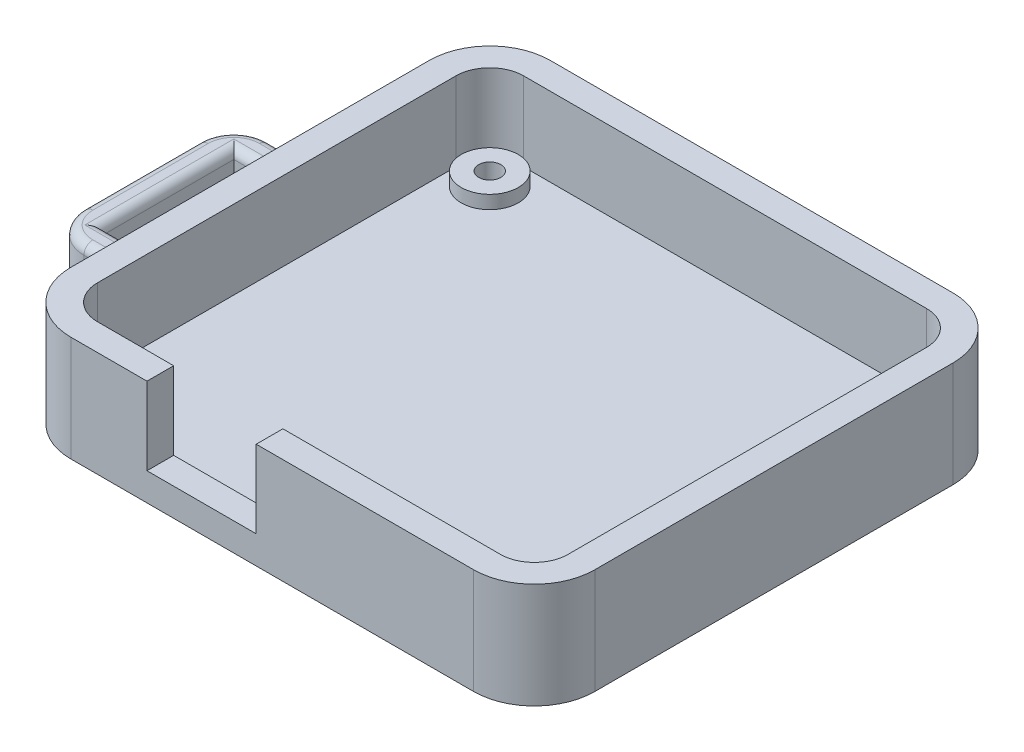
from build123d import *

# Parameters (mm, degrees)
BOSS_EXTRUDE1_DEPTH = 3
CUT_EXTRUDE1_REACH  = 77.661
SKETCH1_3_R         = 1.25
BOSS_EXTRUDE2_START = 8.86
BOSS_EXTRUDE2_DEPTH = 8.86
BOSS_EXTRUDE3_START = 1.5
SKETCH1_5_R         = 3.21
SKETCH1_5_R_2       = 1.25
BOSS_EXTRUDE3_DEPTH = 1.5
SKETCH2_W           = 12.28
SKETCH2_H           = 8.73
CUT_EXTRUDE2_DEPTH  = 3
SKETCH7_W           = 7.2
SKETCH7_H           = 14.75
BOSS_EXTRUDE6_DEPTH = 5
FILLET3_R           = 1


with BuildPart() as part:
    # Sketch1 → Boss-Extrude1 (new body)
    with BuildSketch(Plane(origin=(0, 0, 0), x_dir=(1, 0, 0), z_dir=(0, 1, 0))):
        with BuildLine():
            Line((3.81, 3), (49.09, 3))
            ThreePointArc((49.09, 3), (53.90539718, 1.00539718), (55.9, -3.81))
            Line((55.9, -3.81), (55.9, -44.09))
            ThreePointArc((55.9, -44.09), (53.90539718, -48.90539718), (49.09, -50.9))
            Line((49.09, -50.9), (3.81, -50.9))
            ThreePointArc((3.81, -50.9), (-1.00539718, -48.90539718), (-3, -44.09))
            Line((-3, -44.09), (-3, -3.81))
            ThreePointArc((-3, -3.81), (-1.00539718, 1.00539718), (3.81, 3))
        make_face()
    extrude(amount=-BOSS_EXTRUDE1_DEPTH)

    # Sketch1<3> → Cut-Extrude1 (cut, up to next)
    with BuildSketch(Plane(origin=(0, 0, 0), x_dir=(1, 0, 0), z_dir=(0, 1, 0)), mode=Mode.PRIVATE) as cut_extrude1_sk1:
        with Locations((49.09, -44.09)):
            Circle(SKETCH1_3_R)
    cut_extrude1_tool1 = extrude(cut_extrude1_sk1.sketch, amount=-CUT_EXTRUDE1_REACH, mode=Mode.PRIVATE) & part.part
    # Sketch1<3> → Cut-Extrude1 (cut, up to next)
    with BuildSketch(Plane(origin=(0, 0, 0), x_dir=(1, 0, 0), z_dir=(0, 1, 0)), mode=Mode.PRIVATE) as cut_extrude1_sk2:
        with Locations((3.81, -44.09)):
            Circle(SKETCH1_3_R)
    cut_extrude1_tool2 = extrude(cut_extrude1_sk2.sketch, amount=-CUT_EXTRUDE1_REACH, mode=Mode.PRIVATE) & part.part
    # Sketch1<3> → Cut-Extrude1 (cut, up to next)
    with BuildSketch(Plane(origin=(0, 0, 0), x_dir=(1, 0, 0), z_dir=(0, 1, 0)), mode=Mode.PRIVATE) as cut_extrude1_sk3:
        with Locations((3.81, -3.81)):
            Circle(SKETCH1_3_R)
    cut_extrude1_tool3 = extrude(cut_extrude1_sk3.sketch, amount=-CUT_EXTRUDE1_REACH, mode=Mode.PRIVATE) & part.part
    # Sketch1<3> → Cut-Extrude1 (cut, up to next)
    with BuildSketch(Plane(origin=(0, 0, 0), x_dir=(1, 0, 0), z_dir=(0, 1, 0)), mode=Mode.PRIVATE) as cut_extrude1_sk4:
        with Locations((49.09, -3.81)):
            Circle(SKETCH1_3_R)
    cut_extrude1_tool4 = extrude(cut_extrude1_sk4.sketch, amount=-CUT_EXTRUDE1_REACH, mode=Mode.PRIVATE) & part.part
    add(cut_extrude1_tool1.solids().sort_by_distance((49.09, 0, 44.09))[0], mode=Mode.SUBTRACT)
    add(cut_extrude1_tool2.solids().sort_by_distance((3.81, 0, 44.09))[0], mode=Mode.SUBTRACT)
    add(cut_extrude1_tool3.solids().sort_by_distance((3.81, 0, 3.81))[0], mode=Mode.SUBTRACT)
    add(cut_extrude1_tool4.solids().sort_by_distance((49.09, 0, 3.81))[0], mode=Mode.SUBTRACT)

    # Sketch1<4> → Boss-Extrude2 (add)
    with BuildSketch(Plane(origin=(0, 0, 0), x_dir=(1, 0, 0), z_dir=(0, 1, 0)).offset(BOSS_EXTRUDE2_START)):
        with BuildLine():
            Line((49.09, 3), (3.81, 3))
            ThreePointArc((3.81, 3), (-1.00539718, 1.00539718), (-3, -3.81))
            Line((-3, -3.81), (-3, -44.09))
            ThreePointArc((-3, -44.09), (-1.00539718, -48.90539718), (3.81, -50.9))
            Line((3.81, -50.9), (49.09, -50.9))
            ThreePointArc((49.09, -50.9), (53.90539718, -48.90539718), (55.9, -44.09))
            Line((55.9, -44.09), (55.9, -3.81))
            ThreePointArc((55.9, -3.81), (53.90539718, 1.00539718), (49.09, 3))
        make_face()
        with BuildLine():
            ThreePointArc((0, -3.81), (1.115923164, -1.115923164), (3.81, 0))
            Line((3.81, 0), (49.09, 0))
            ThreePointArc((49.09, 0), (51.784076836, -1.115923164), (52.9, -3.81))
            Line((52.9, -3.81), (52.9, -44.09))
            ThreePointArc((52.9, -44.09), (51.784076836, -46.784076836), (49.09, -47.9))
            Line((49.09, -47.9), (3.81, -47.9))
            ThreePointArc((3.81, -47.9), (1.115923164, -46.784076836), (0, -44.09))
            Line((0, -44.09), (0, -3.81))
        make_face(mode=Mode.SUBTRACT)
    extrude(amount=-BOSS_EXTRUDE2_DEPTH)

    # Sketch1<5> → Boss-Extrude3 (add)
    # profile 1 of 4: a face of its own
    with BuildSketch(Plane(origin=(0, 0, 0), x_dir=(1, 0, 0), z_dir=(0, 1, 0)).offset(BOSS_EXTRUDE3_START)):
        with Locations((3.81, -3.81)):
            Circle(SKETCH1_5_R)
        with Locations((3.81, -3.81)):
            Circle(SKETCH1_5_R_2, mode=Mode.SUBTRACT)
    # profile 2 of 4: a face of its own
    with BuildSketch(Plane(origin=(0, 0, 0), x_dir=(1, 0, 0), z_dir=(0, 1, 0)).offset(BOSS_EXTRUDE3_START)):
        with Locations((49.09, -3.81)):
            Circle(SKETCH1_5_R)
        with Locations((49.09, -3.81)):
            Circle(SKETCH1_5_R_2, mode=Mode.SUBTRACT)
    # profile 3 of 4: a face of its own
    with BuildSketch(Plane(origin=(0, 0, 0), x_dir=(1, 0, 0), z_dir=(0, 1, 0)).offset(BOSS_EXTRUDE3_START)):
        with Locations((49.09, -44.09)):
            Circle(SKETCH1_5_R)
        with Locations((49.09, -44.09)):
            Circle(SKETCH1_5_R_2, mode=Mode.SUBTRACT)
    # profile 4 of 4: a face of its own
    with BuildSketch(Plane(origin=(0, 0, 0), x_dir=(1, 0, 0), z_dir=(0, 1, 0)).offset(BOSS_EXTRUDE3_START)):
        with Locations((3.81, -44.09)):
            Circle(SKETCH1_5_R)
        with Locations((3.81, -44.09)):
            Circle(SKETCH1_5_R_2, mode=Mode.SUBTRACT)
    extrude(amount=-BOSS_EXTRUDE3_DEPTH)

    # Sketch2 → Cut-Extrude2 (cut)
    with BuildSketch(Plane.XY.offset(50.9)):
        with Locations((18.5, 4.5)):
            Rectangle(SKETCH2_W, SKETCH2_H)
    extrude(amount=-CUT_EXTRUDE2_DEPTH, mode=Mode.SUBTRACT)

    # Sketch7 → Boss-Extrude6 (add)
    with BuildSketch(Plane(origin=(0, -3, 0), x_dir=(-1, 0, 0), z_dir=(0, -1, 0))):
        with BuildLine():
            Line((3, -34.325), (11.3, -34.325))
            ThreePointArc((11.3, -34.325), (14.057716447, -33.182716447), (15.2, -30.425))
            Line((15.2, -30.425), (15.2, -17.475))
            ThreePointArc((15.2, -17.475), (14.057716447, -14.717283553), (11.3, -13.575))
            Line((11.3, -13.575), (3, -13.575))
            Line((3, -13.575), (3, -34.325))
        make_face()
        with Locations((8.6, -23.95)):
            Rectangle(SKETCH7_W, SKETCH7_H, mode=Mode.SUBTRACT)
    extrude(amount=-BOSS_EXTRUDE6_DEPTH)

    # Fillet3
    fillet3_edges = [part.edges().sort_by_distance(p)[0] for p in [
        (-7.15, 2, 34.325),
        (-14.057716447, 2, 33.182716447),
        (-15.2, 2, 23.95),
        (-14.057716447, 2, 14.717283553),
        (-7.15, 2, 13.575),
        (-8.6, 2, 16.575),
        (-5, 2, 23.95),
        (-12.2, 2, 23.95),
        (-8.6, 2, 31.325),
    ]]
    fillet(fillet3_edges, radius=FILLET3_R)


solid = part.part
